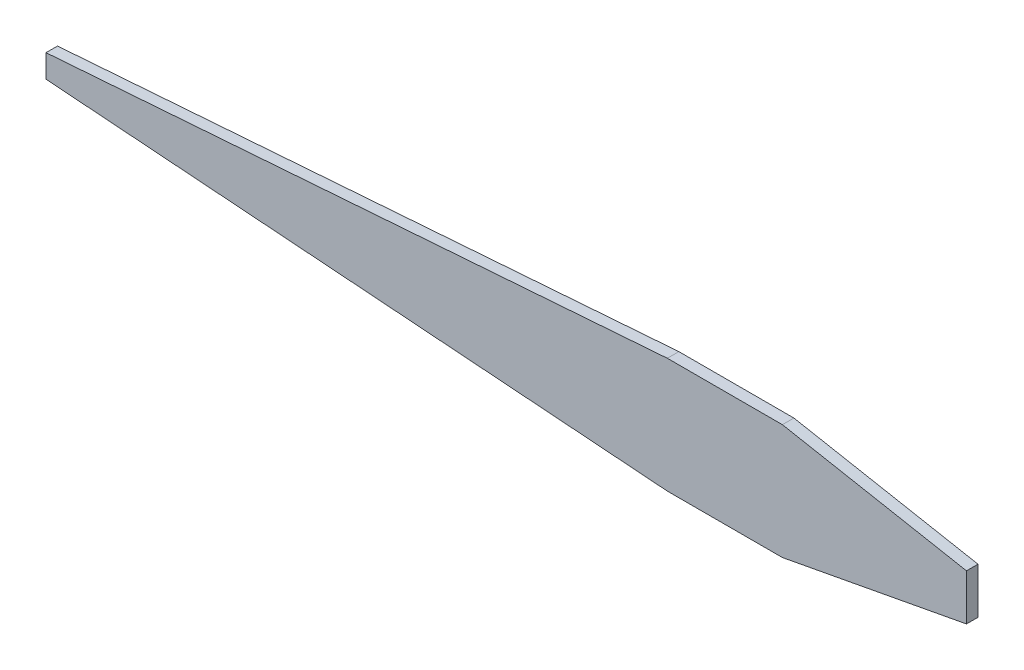
from build123d import *

# Parameters (mm, degrees)
BOSS_EXTRUDE1_DEPTH = 5


with BuildPart() as part:
    # Sketch1 → Boss-Extrude1 (new, symmetric)
    with BuildSketch(Plane.XY):
        Polygon((200, 20), (40, 50), (-60, 50), (-600, 10), (-600, -10), (-60, -50), (40, -50), (200, -20), align=None)
    extrude(amount=BOSS_EXTRUDE1_DEPTH, both=True)


solid = part.part
